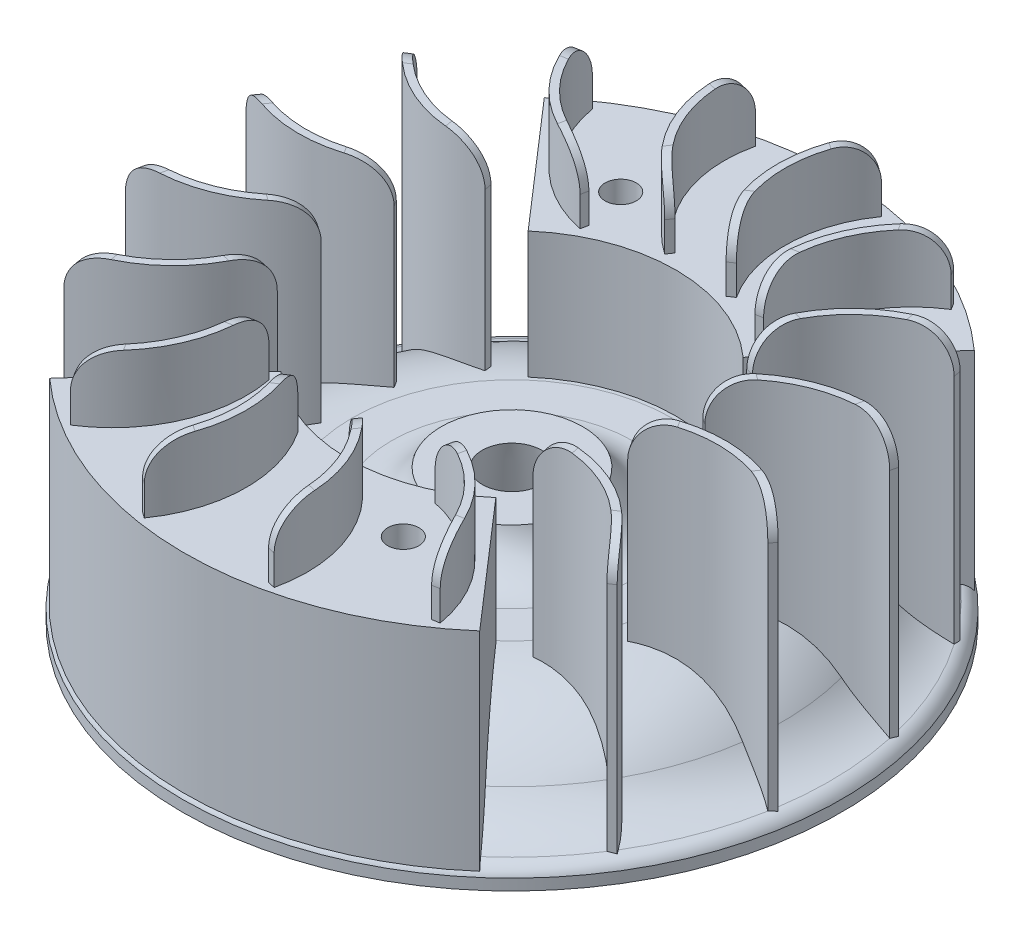
from build123d import *

# Parameters (mm, degrees)
BOSS_EXTRUDE1_REACH      = 75.797
FILLET1_R                = 5
CIRPATTERN1_COUNT        = 16
FILLET1_OF_CIRPATTERN1_R = 5
BOSS_EXTRUDE15_REACH     = 84.797
BOSS_EXTRUDE15_START     = -9
M5_TAPPED_HOLE3_D        = 4.2
M5_TAPPED_HOLE3_DEPTH    = 13.5
M5_TAPPED_HOLE3_TIP      = 1.2618073


with BuildPart() as part:
    # Sketch1 → Revolve2 (revolve)
    with BuildSketch(Plane.XY, mode=Mode.PRIVATE) as revolve2_sk:
        with BuildLine():
            Line((4, 0), (9.5, 0))
            ThreePointArc((9.5, 0), (12.0249038, -3.61248608), (16.208203932, -5))
            Line((16.208203932, -5), (21.5, -5))
            ThreePointArc((21.5, -5), (29.575346034, -6.702765607), (36.275649918, -11.521121356))
            ThreePointArc((36.275649918, -11.521121356), (39.204032754, -13.862214305), (42.711939315, -15.185367278))
            ThreePointArc((42.711939315, -15.185367278), (43.669491059, -15.645151731), (44.3, -16.5))
            Line((44.3, -16.5), (44.3, -18))
            Line((44.3, -18), (41.481550703, -18))
            ThreePointArc((41.481550703, -18), (40.608015893, -17.819142624), (39.878104005, -17.306306306))
            ThreePointArc((39.878104005, -17.306306306), (33.242541386, -12.644157962), (25.301315846, -11))
            Line((25.301315846, -11), (6, -11))
            Line((6, -11), (4, 0))
        make_face()
    revolve(revolve2_sk.sketch.rotate(Axis((0, 0, 0), (0, 1, 0)), 90), axis=Axis((0, 0, 0), (0, 1, 0)))

    # Sketch2 → Boss-Extrude1 (add, up to next)
    with BuildSketch(Plane(origin=(0, 21, 0), x_dir=(1, 0, 0), z_dir=(0, 1, 0)), mode=Mode.PRIVATE) as boss_extrude1_sk1:
        with BuildLine():
            Line((23.089311007, 2.561892181), (23.916521486, 2))
            ThreePointArc((23.916521486, 2), (31.747784211, 8.264618563), (41.747590447, 9.024879606))
            Line((41.747590447, 9.024879606), (41.969266378, 10))
            ThreePointArc((41.969266378, 10), (31.381236246, 9.195017718), (23.089311007, 2.561892181))
        make_face()
    boss_extrude1_tool1 = extrude(boss_extrude1_sk1.sketch, amount=-BOSS_EXTRUDE1_REACH, mode=Mode.PRIVATE) - part.part
    boss_extrude1 = boss_extrude1_tool1.solids().sort_by_distance((23.619137, 21, -2.452044))[0]
    add(boss_extrude1)

    # Fillet1
    fillet1_edges = [part.edges().sort_by_distance(p)[0] for p in [
        (23.502916247, 21, -2.280946091),
        (41.858428412, 21, -9.512439803),
    ]]
    fillet(fillet1_edges, radius=FILLET1_R)

    # CirPattern1: Boss-Extrude1 ×16 about axis
    cirpattern1_axis = Axis((0, 0, 0), (0, 1, 0))
    for i in range(1, CIRPATTERN1_COUNT):
        add(boss_extrude1.rotate(cirpattern1_axis, i * 360 / CIRPATTERN1_COUNT))

    # Fillet1 of CirPattern1
    fillet1_of_cirpattern1_edges = [part.edges().sort_by_distance(p)[0] for p in [
        (20.840982996, 21, -11.101496068),
        (35.031892159, 21, -24.806875497),
        (15.006199007, 21, -18.231943904),
        (22.87206789, 21, -36.324689271),
        (6.886857252, 21, -22.586743554),
        (7.23017862, 21, -42.312398387),
        (-2.280946091, 21, -23.502916247),
        (-9.512439803, 21, -41.858428412),
        (-11.101496068, 21, -20.840982996),
        (-24.806875497, 21, -35.031892159),
        (-18.231943904, 21, -15.006199007),
        (-36.324689271, 21, -22.87206789),
        (-22.586743554, 21, -6.886857252),
        (-42.312398387, 21, -7.23017862),
        (-23.502916247, 21, 2.280946091),
        (-41.858428412, 21, 9.512439803),
        (-20.840982996, 21, 11.101496068),
        (-35.031892159, 21, 24.806875497),
        (-15.006199007, 21, 18.231943904),
        (-22.87206789, 21, 36.324689271),
        (-6.886857252, 21, 22.586743554),
        (-7.23017862, 21, 42.312398387),
        (2.280946091, 21, 23.502916247),
        (9.512439803, 21, 41.858428412),
        (11.101496068, 21, 20.840982996),
        (24.806875497, 21, 35.031892159),
        (18.231943904, 21, 15.006199007),
        (36.324689271, 21, 22.87206789),
        (22.586743554, 21, 6.886857252),
        (42.312398387, 21, 7.23017862),
    ]]
    fillet(fillet1_of_cirpattern1_edges, radius=FILLET1_OF_CIRPATTERN1_R)

    # Sketch7 → Boss-Extrude15 (add, up to next)
    with BuildSketch(Plane(origin=(0, 21, 0), x_dir=(1, 0, 0), z_dir=(0, 1, 0)).offset(BOSS_EXTRUDE15_START), mode=Mode.PRIVATE) as boss_extrude15_sk1:
        with BuildLine():
            Line((-14.433298638, 16.603610765), (-28.866597276, 33.20722153))
            ThreePointArc((-28.866597276, 33.20722153), (0.383967562, 43.998324615), (29.44174668, 32.698372321))
            Line((29.44174668, 32.698372321), (14.72087334, 16.349186161))
            ThreePointArc((14.72087334, 16.349186161), (0.191983781, 21.999162307), (-14.433298638, 16.603610765))
        make_face()
    boss_extrude15_tool1 = extrude(boss_extrude15_sk1.sketch, amount=-BOSS_EXTRUDE15_REACH, mode=Mode.PRIVATE) - part.part
    # Sketch7 → Boss-Extrude15 (add, up to next)
    with BuildSketch(Plane(origin=(0, 21, 0), x_dir=(1, 0, 0), z_dir=(0, 1, 0)).offset(BOSS_EXTRUDE15_START), mode=Mode.PRIVATE) as boss_extrude15_sk2:
        with BuildLine():
            Line((-14.72087334, -16.349186161), (-29.44174668, -32.698372321))
            ThreePointArc((-29.44174668, -32.698372321), (-0.383967562, -43.998324615), (28.866597276, -33.20722153))
            Line((28.866597276, -33.20722153), (14.433298638, -16.603610765))
            ThreePointArc((14.433298638, -16.603610765), (-0.191983781, -21.999162307), (-14.72087334, -16.349186161))
        make_face()
    boss_extrude15_tool2 = extrude(boss_extrude15_sk2.sketch, amount=-BOSS_EXTRUDE15_REACH, mode=Mode.PRIVATE) - part.part
    add(boss_extrude15_tool1.solids().sort_by_distance((0.273205, 12, -31.30623))[0])
    add(boss_extrude15_tool2.solids().sort_by_distance((-0.273205, 12, 31.30623))[0])

    # M5 Tapped Hole3
    with Locations(Plane(origin=(-12.764540788, 12, -27.373646057), x_dir=(0, 0, 1), z_dir=(0, 1, 0))):
        with Locations((0, 0), (-1.184302136, 22.59783093), (55.93159425, 2.931250646), (54.747292114, 25.529081576)):
            Hole(M5_TAPPED_HOLE3_D / 2, depth=M5_TAPPED_HOLE3_DEPTH)
            with Locations((0, 0, -(M5_TAPPED_HOLE3_DEPTH + M5_TAPPED_HOLE3_TIP / 2))):  # 118° drill point
                Cone(0, M5_TAPPED_HOLE3_D / 2, M5_TAPPED_HOLE3_TIP, mode=Mode.SUBTRACT)


solid = part.part
